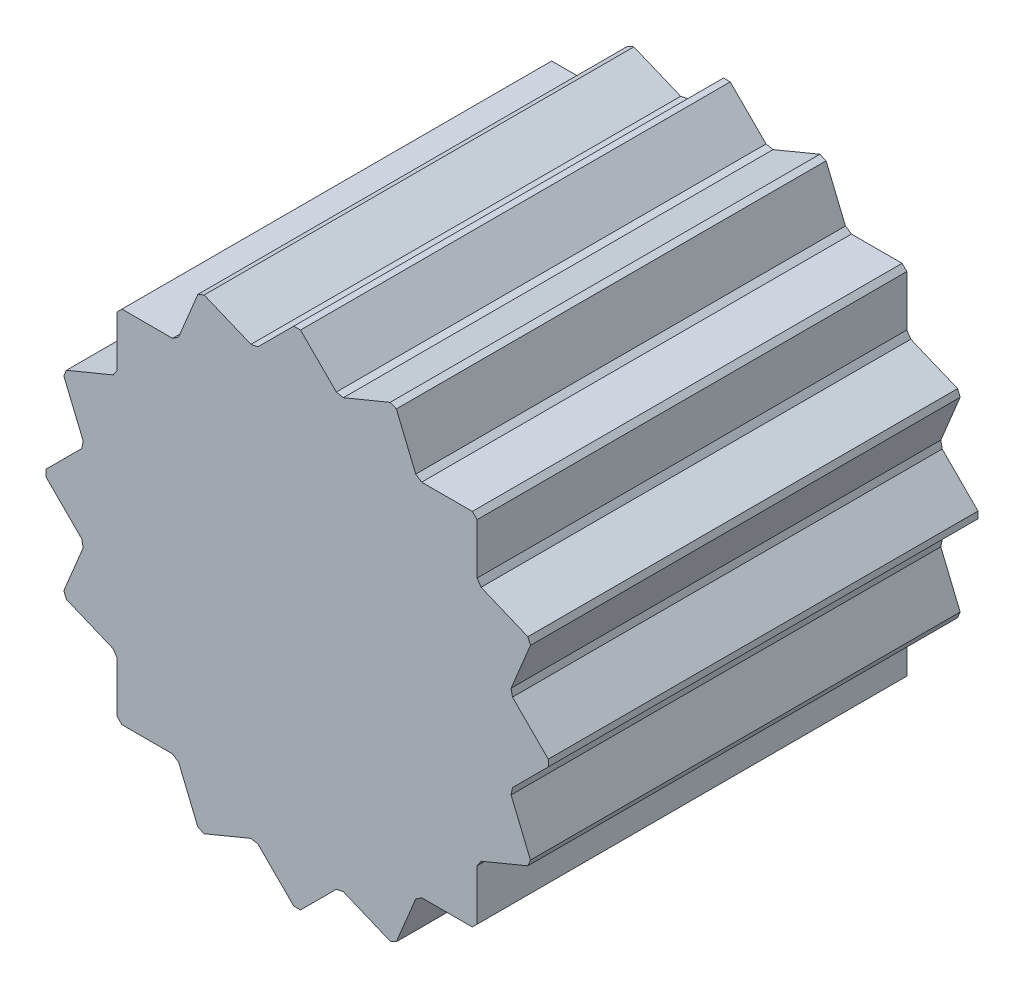
from build123d import *

# Parameters (mm, degrees)
SKETCH2_R           = 15.278874537
BOSS_EXTRUDE1_DEPTH = 30
BOSS_EXTRUDE2_DEPTH = 30
CIRPATTERN1_COUNT   = 16


with BuildPart() as part:
    # Sketch2 → Boss-Extrude1 (new body)
    with BuildSketch(Plane.XY):
        Circle(SKETCH2_R)
    extrude(amount=BOSS_EXTRUDE1_DEPTH)

    # Sketch3 → Boss-Extrude2 (add)
    with BuildSketch(Plane(origin=(0, 0, 0), x_dir=(-1, 0, 0), z_dir=(0, 0, -1))):
        with BuildLine():
            Line((-2.735176163, 15.032059688), (-0.235176163, 17.532059688))
            Line((-0.235176163, 17.532059688), (0.235176163, 17.532059688))
            Line((0.235176163, 17.532059688), (2.735176163, 15.032059688))
            ThreePointArc((2.735176163, 15.032059688), (0, 15.278874537), (-2.735176163, 15.032059688))
        make_face()
    boss_extrude2 = extrude(amount=-BOSS_EXTRUDE2_DEPTH)

    # CirPattern1: Boss-Extrude2 ×16 about axis
    cirpattern1_axis = Axis((0, 0, 0), (0, 0, 1))
    for i in range(1, CIRPATTERN1_COUNT):
        add(boss_extrude2.rotate(cirpattern1_axis, i * 360 / CIRPATTERN1_COUNT))


solid = part.part
